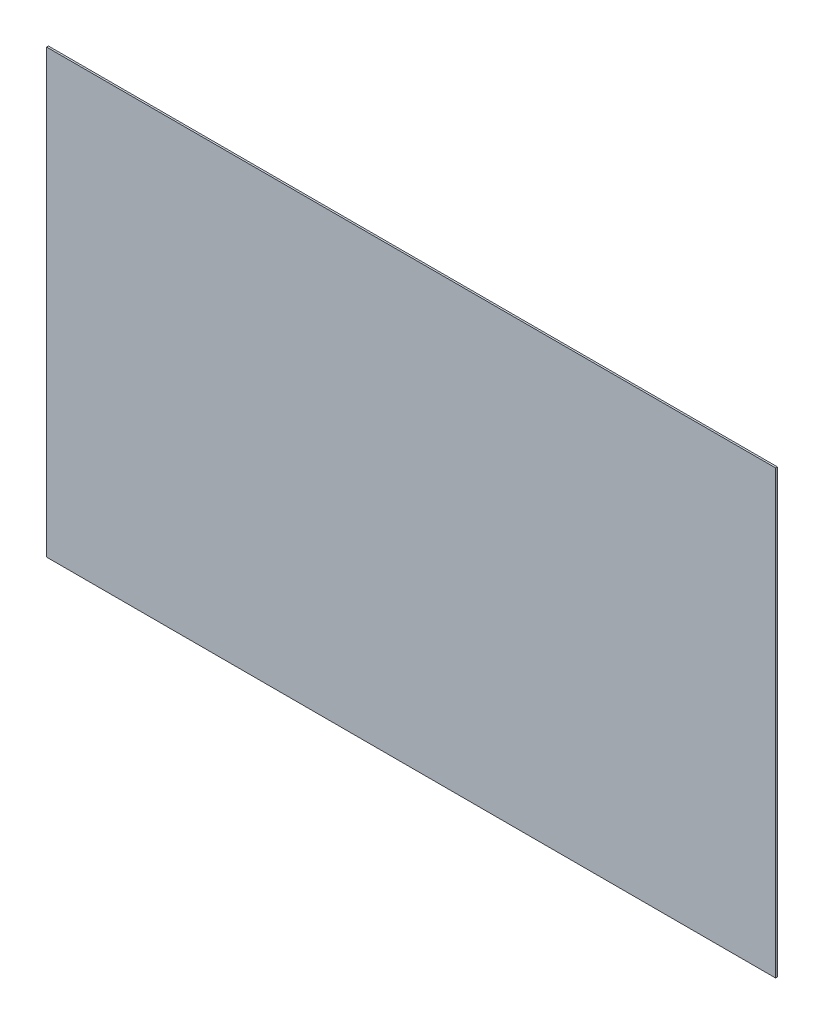
from build123d import *

# Parameters (mm, degrees)
SKETCH1_W           = 628.65
SKETCH1_H           = 381
BOSS_EXTRUDE1_DEPTH = 1.5875


with BuildPart() as part:
    # Sketch1 → Boss-Extrude1 (new body)
    with BuildSketch(Plane.XY):
        with Locations((314.325, 190.5)):
            Rectangle(SKETCH1_W, SKETCH1_H)
    extrude(amount=BOSS_EXTRUDE1_DEPTH)


solid = part.part
